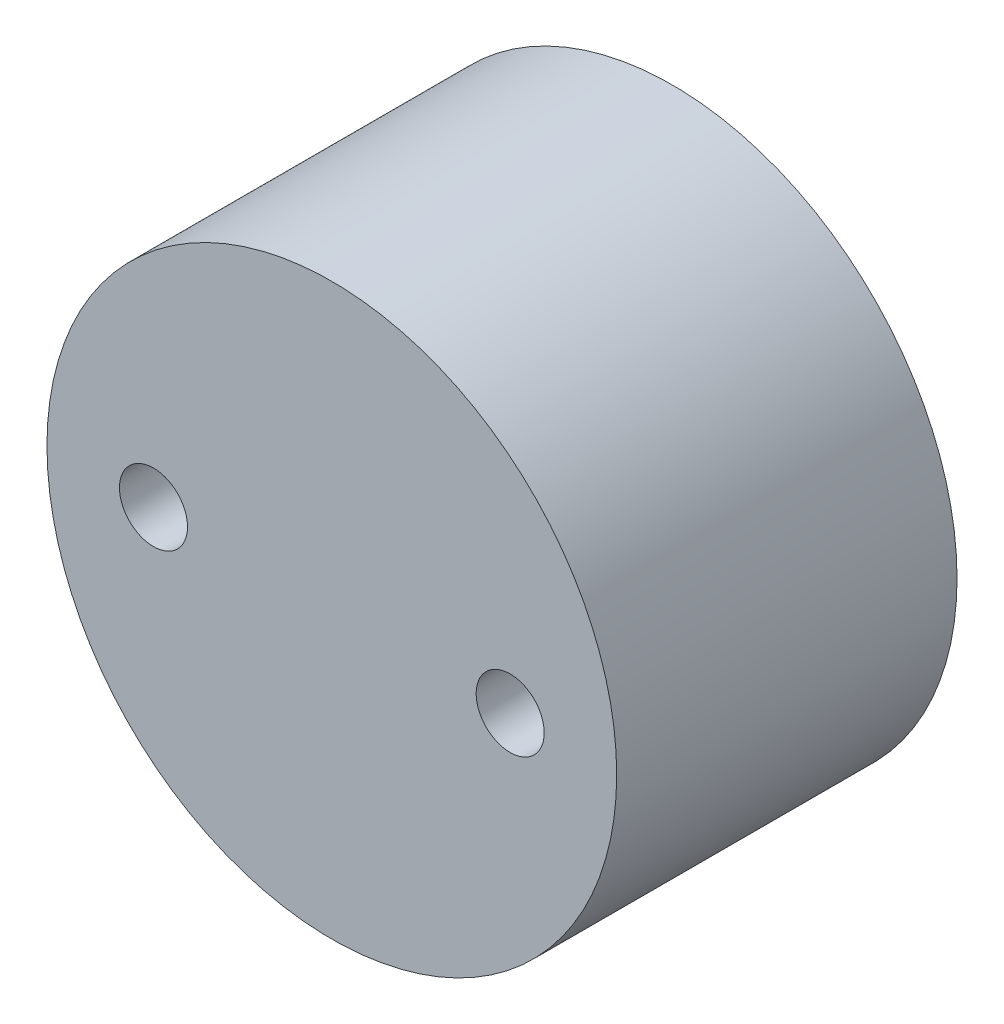
from build123d import *

# Parameters (mm, degrees)
SKETCH1_R           = 4.185
BOSS_EXTRUDE1_DEPTH = 5
SKETCH2_R           = 0.5
CUT_EXTRUDE1_DEPTH  = 8.747802914


with BuildPart() as part:
    # Sketch1 → Boss-Extrude1 (new body)
    with BuildSketch(Plane.XY):
        Circle(SKETCH1_R)
    extrude(amount=BOSS_EXTRUDE1_DEPTH)

    # Sketch2 → Cut-Extrude1 (cut, through all)
    with BuildSketch(Plane.XY.offset(5)):
        with Locations((-2.62, 0)):
            Circle(SKETCH2_R)
        with Locations(Location((2.62, 0, 0), (0, 0, 180))):
            Circle(SKETCH2_R)
    extrude(amount=-CUT_EXTRUDE1_DEPTH, mode=Mode.SUBTRACT)


solid = part.part
